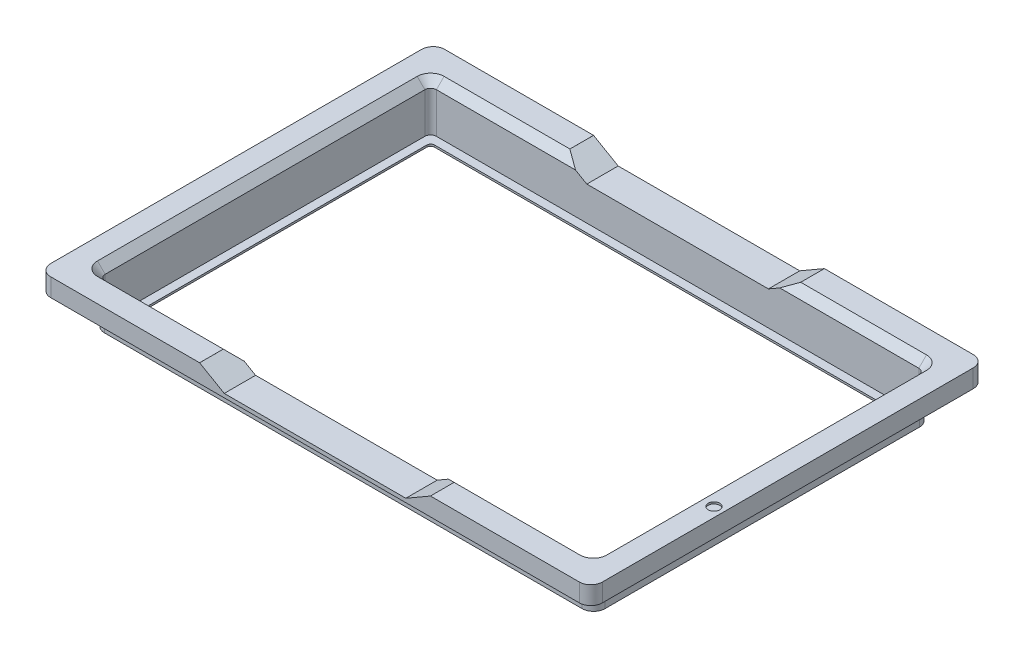
from build123d import *

# Parameters (mm, degrees)
SKETCH1_W                            = 143.4
SKETCH1_H                            = 102.4
SKETCH1_W_2                          = 124
SKETCH1_H_2                          = 81.7
BOSS_EXTRUDE1_DEPTH                  = 13
SKETCH2_W                            = 128.4
SKETCH2_H                            = 86.1
CUT_EXTRUDE1_DEPTH                   = 12.5
SKETCH3_W                            = 143.4
SKETCH3_H                            = 102.4
SKETCH3_W_2                          = 130.1
SKETCH3_H_2                          = 87.7
CUT_EXTRUDE3_DEPTH                   = 8.3
FILLET1_R                            = 1
FILLET2_R                            = 1.5
FILLET3_R                            = 3
SKETCH4_W                            = 60
SKETCH4_H                            = 8.15
CUT_EXTRUDE4_DEPTH                   = 3.7
CHAMFER1_SIZE                        = 6.4
CHAMFER1_SIZE2                       = 3.695041723
CHAMFER2_SIZE                        = 6.4
CHAMFER2_SIZE2                       = 3.695041723
SKETCH5_R                            = 1.5
CUT_EXTRUDE5_DEPTH                   = 0.5
CHAMFER3_SIZE                        = 2
F_3_7_3_7_DIAMETER_HOLE1_D           = 3.7
F_3_7_3_7_DIAMETER_HOLE1_DEPTH       = 3
F_3_7_3_7_DIAMETER_HOLE1_CSINK_D     = 3.75
F_3_7_3_7_DIAMETER_HOLE1_CSINK_ANGLE = 90
F_3_7_3_7_DIAMETER_HOLE1_TIP         = 1.111592145


with BuildPart() as part:
    # Sketch1 → Boss-Extrude1 (new body)
    with BuildSketch(Plane(origin=(0, 0, 0), x_dir=(1, 0, 0), z_dir=(0, 1, 0))):
        Rectangle(SKETCH1_W, SKETCH1_H)
        Rectangle(SKETCH1_W_2, SKETCH1_H_2, mode=Mode.SUBTRACT)
    extrude(amount=BOSS_EXTRUDE1_DEPTH)

    # Sketch2 → Cut-Extrude1 (cut)
    with BuildSketch(Plane(origin=(0, 13, 0), x_dir=(1, 0, 0), z_dir=(0, 1, 0))):
        Rectangle(SKETCH2_W, SKETCH2_H)
    extrude(amount=-CUT_EXTRUDE1_DEPTH, mode=Mode.SUBTRACT)

    # Sketch3 → Cut-Extrude3 (cut)
    with BuildSketch(Plane.XZ):
        Rectangle(SKETCH3_W, SKETCH3_H)
        Rectangle(SKETCH3_W_2, SKETCH3_H_2, mode=Mode.SUBTRACT)
    extrude(amount=-CUT_EXTRUDE3_DEPTH, mode=Mode.SUBTRACT)

    # Fillet1
    fillet1_edges = [part.edges().sort_by_distance(p)[0] for p in [
        (-62, 0.25, 40.85),
        (62, 0.25, 40.85),
        (-62, 0.25, -40.85),
        (62, 0.25, -40.85),
    ]]
    fillet(fillet1_edges, radius=FILLET1_R)

    # Fillet2
    fillet2_edges = [part.edges().sort_by_distance(p)[0] for p in [
        (64.2, 6.75, -43.05),
        (64.2, 6.75, 43.05),
        (-64.2, 6.75, 43.05),
        (-64.2, 6.75, -43.05),
    ]]
    fillet(fillet2_edges, radius=FILLET2_R)

    # Fillet3
    fillet3_edges = [part.edges().sort_by_distance(p)[0] for p in [
        (65.05, 4.15, -43.85),
        (-65.05, 4.15, -43.85),
        (-65.05, 4.15, 43.85),
        (65.05, 4.15, 43.85),
        (71.7, 10.65, 51.2),
        (-71.7, 10.65, 51.2),
        (-71.7, 10.65, -51.2),
        (71.7, 10.65, -51.2),
    ]]
    fillet(fillet3_edges, radius=FILLET3_R)

    # Sketch4 → Cut-Extrude4 (cut)
    with BuildSketch(Plane(origin=(0, 13, 0), x_dir=(1, 0, 0), z_dir=(0, 1, 0))):
        with Locations((0, 47.125)):
            Rectangle(SKETCH4_W, SKETCH4_H)
    cut_extrude4 = extrude(amount=-CUT_EXTRUDE4_DEPTH, mode=Mode.SUBTRACT)

    # Mirror1: Cut-Extrude4 across plane
    add(cut_extrude4.mirror(Plane.XY), mode=Mode.SUBTRACT)

    # Chamfer1
    chamfer1_edges = [part.edges().sort_by_distance(p)[0] for p in [
        (-30, 9.3, -47.125),
        (30, 9.3, -47.125),
    ]]
    chamfer1_side = [part.faces().sort_by_distance(p)[0] for p in [
        (0, 9.3, -47.125),
    ]]
    chamfer(chamfer1_edges, length=CHAMFER1_SIZE, length2=CHAMFER1_SIZE2, reference=chamfer1_side[0])

    # Chamfer2
    chamfer2_edges = [part.edges().sort_by_distance(p)[0] for p in [
        (30, 9.3, 47.125),
        (-30, 9.3, 47.125),
    ]]
    chamfer2_side = [part.faces().sort_by_distance(p)[0] for p in [
        (0, 9.3, 47.125),
    ]]
    chamfer(chamfer2_edges, length=CHAMFER2_SIZE, length2=CHAMFER2_SIZE2, reference=chamfer2_side[0])

    # Sketch5 → Cut-Extrude5 (cut)
    with BuildSketch(Plane(origin=(0, 13, 0), x_dir=(1, 0, 0), z_dir=(0, 1, 0))):
        with Locations(Location((69.2, -16.7, 0), (0, 0, 270))):
            Circle(SKETCH5_R)
    extrude(amount=-CUT_EXTRUDE5_DEPTH, mode=Mode.SUBTRACT)

    # Chamfer3
    chamfer3_edges = [part.edges().sort_by_distance(p)[0] for p in [
        (46.35, 13, 43.05),
        (63.760660172, 13, 42.610660172),
        (64.2, 13, 0),
        (63.760660172, 13, -42.610660172),
        (46.35, 13, -43.05),
        (-46.35, 13, -43.05),
        (-46.35, 13, 43.05),
        (-63.760660172, 13, -42.610660172),
        (-63.760660172, 13, 42.610660172),
        (-64.2, 13, 0),
    ]]
    chamfer(chamfer3_edges, length=CHAMFER3_SIZE)

    # Ø3.7 (3.7) Diameter Hole1
    with Locations(Plane(origin=(0, 8.3, 0), x_dir=(-1, 0, 0), z_dir=(0, -1, 0))):
        with Locations((-68, 47.5), (-68, -47.5), (68, 47.5), (68, -47.5)):
            CounterSinkHole(F_3_7_3_7_DIAMETER_HOLE1_D / 2, F_3_7_3_7_DIAMETER_HOLE1_CSINK_D / 2, depth=F_3_7_3_7_DIAMETER_HOLE1_DEPTH, counter_sink_angle=F_3_7_3_7_DIAMETER_HOLE1_CSINK_ANGLE)
            with Locations((0, 0, -(F_3_7_3_7_DIAMETER_HOLE1_DEPTH + F_3_7_3_7_DIAMETER_HOLE1_TIP / 2))):  # 118° drill point
                Cone(0, F_3_7_3_7_DIAMETER_HOLE1_D / 2, F_3_7_3_7_DIAMETER_HOLE1_TIP, mode=Mode.SUBTRACT)


solid = part.part
